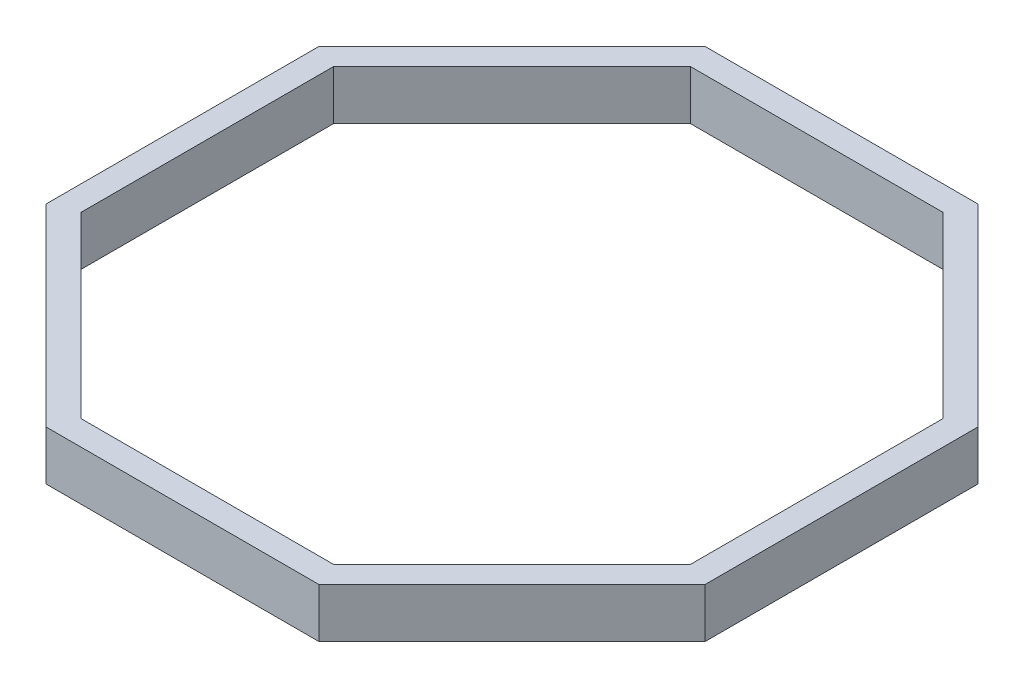
from build123d import *

# Parameters (mm, degrees)
RESSALTO_EXTRUS_O1_DEPTH = 30
CORTE_EXTRUS_O1_DEPTH    = 30


with BuildPart() as part:
    # Esboço2 → Ressalto-extrusão1 (new body)
    with BuildSketch(Plane(origin=(0, 0, 0), x_dir=(1, 0, 0), z_dir=(0, 1, 0))):
        Polygon((200, 82.842712475), (82.842712475, 200), (-82.842712475, 200), (-200, 82.842712475), (-200, -82.842712475), (-82.842712475, -200), (82.842712475, -200), (200, -82.842712475), align=None)
    extrude(amount=RESSALTO_EXTRUS_O1_DEPTH)

    # Esboço3 → Corte-extrusão1 (cut)
    with BuildSketch(Plane(origin=(0, 30, 0), x_dir=(1, 0, 0), z_dir=(0, 1, 0))):
        Polygon((185, 76.629509039), (76.629509039, 185), (-76.629509039, 185), (-185, 76.629509039), (-185, -76.629509039), (-76.629509039, -185), (76.629509039, -185), (185, -76.629509039), align=None)
    extrude(amount=-CORTE_EXTRUS_O1_DEPTH, mode=Mode.SUBTRACT)


solid = part.part
